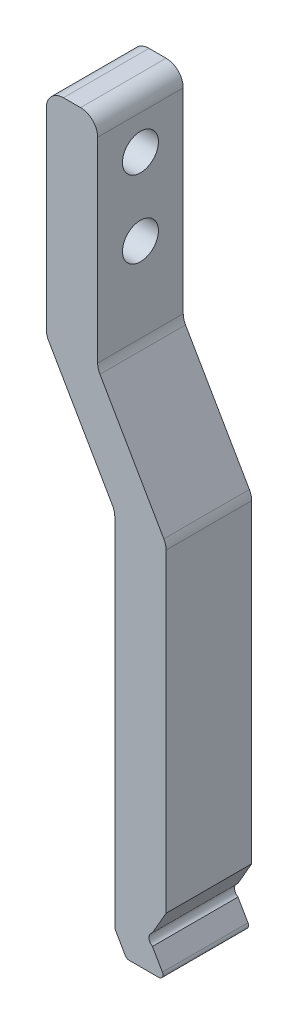
from build123d import *

# Parameters (mm, degrees)
EXTRUDE_1_DEPTH     = 10
SKETCH_2_R          = 2.1
CUT_EXTRUDE_1_DEPTH = 82.018516402
SKETCH_3_R          = 0.8
CUT_EXTRUDE_2_DEPTH = 84.839131675
FILLET_1_R          = 0.5
FILLET_2_R          = 2


with BuildPart() as part:
    # 草图1 → 凸台-拉伸1 (new body)
    with BuildSketch(Plane.XY):
        Polygon((-9, 3.464101615), (-11, 0), (-9, -3.464101615), (-15, -3.464101615), (-15, 41.143593539), (-23, 55), (-23, 80), (-17, 80), (-17, 54.607695155), (-9, 40.751288694), align=None)
    extrude(amount=EXTRUDE_1_DEPTH)

    # 草图2 → 切除-拉伸1 (cut, through all)
    with BuildSketch(Plane(origin=(-17, 0, 0), x_dir=(0, 0, -1), z_dir=(1, 0, 0))):
        with Locations(Location((-5, 65, 0), (0, 0, 90))):
            Circle(SKETCH_2_R)
        with Locations(Location((-5, 74, 0), (0, 0, 90))):
            Circle(SKETCH_2_R)
    extrude(amount=-CUT_EXTRUDE_1_DEPTH, mode=Mode.SUBTRACT)

    # 草图3 → 切除-拉伸2 (cut, through all)
    with BuildSketch(Plane.XY.offset(10)):
        with Locations((-10.2, 0)):
            Circle(SKETCH_3_R)
        Polygon((-15, -1.07179677), (-13.618802154, -3.464101615), (-15, -3.464101615), align=None)
    extrude(amount=-CUT_EXTRUDE_2_DEPTH, mode=Mode.SUBTRACT)

    # 圆角1
    fillet_1_edges = [part.edges().sort_by_distance(p)[0] for p in [
        (-9, -3.464101615, 5),
        (-15, -1.07179677, 5),
        (-13.618802154, -3.464101615, 5),
    ]]
    fillet(fillet_1_edges, radius=FILLET_1_R)

    # 圆角2
    fillet_2_edges = [part.edges().sort_by_distance(p)[0] for p in [
        (-15, 41.143593539, 5),
        (-23, 55, 5),
        (-23, 80, 5),
        (-17, 80, 5),
        (-17, 54.607695155, 5),
        (-9, 40.751288694, 5),
    ]]
    fillet(fillet_2_edges, radius=FILLET_2_R)


solid = part.part
